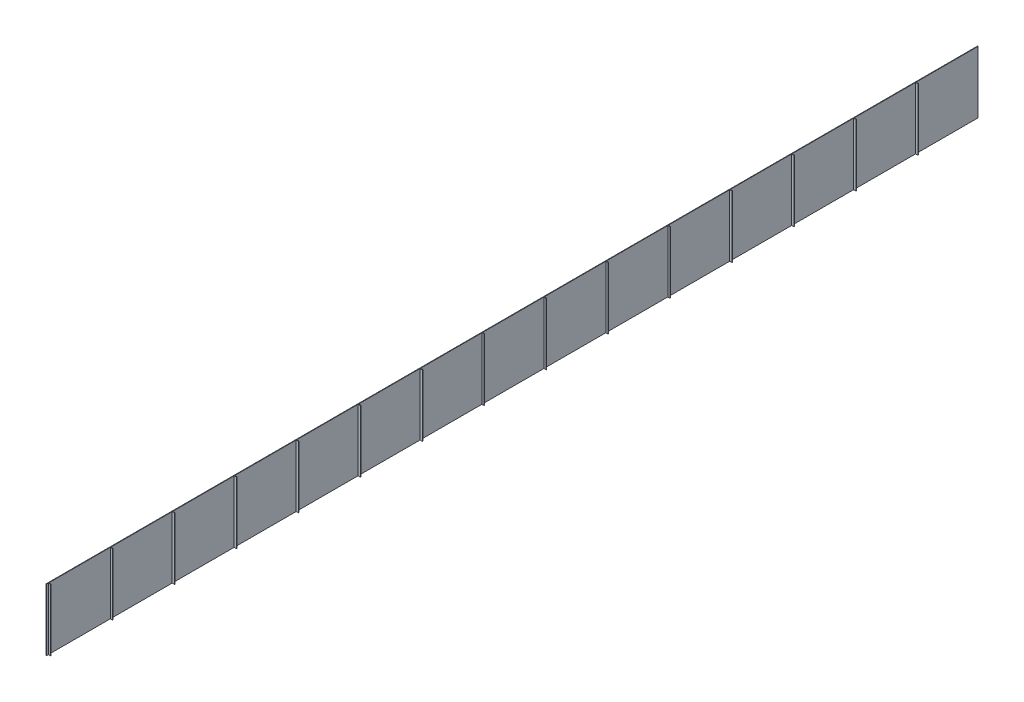
from build123d import *

# Parameters (mm, degrees)
SKETCH_1_W             = 2.8
SKETCH_1_H             = 332.5
EXTRUDE_1_DEPTH        = 5000
SKETCH_2_W             = 2.8
SKETCH_2_H             = 332.5
EXTRUDE_2_DEPTH        = 12.2
PATTERN_LINEAR_1_COUNT = 15
PATTERN_LINEAR_1_PITCH = 332.5


with BuildPart() as part:
    # 草图1 → 凸台-拉伸1 (new body)
    with BuildSketch(Plane.XY):
        Rectangle(SKETCH_1_W, SKETCH_1_H)
    extrude(amount=EXTRUDE_1_DEPTH)


with BuildPart() as body_2:
    # 草图2 → 凸台-拉伸2 (new body)
    with BuildSketch(Plane(origin=(1.4, 0, 0), x_dir=(0, 0, -1), z_dir=(1, 0, 0))):
        with Locations((-333.9, 0)):
            Rectangle(SKETCH_2_W, SKETCH_2_H)
    extrude_2 = extrude(amount=EXTRUDE_2_DEPTH)


with BuildPart() as pattern_linear_1_1:
    # 阵列(线性)1: 凸台-拉伸2 ×15
    with Locations(*[(0, 0, i * PATTERN_LINEAR_1_PITCH) for i in range(1, PATTERN_LINEAR_1_COUNT)]):
        add(extrude_2)


solid = Compound([part.part, body_2.part, pattern_linear_1_1.part])
